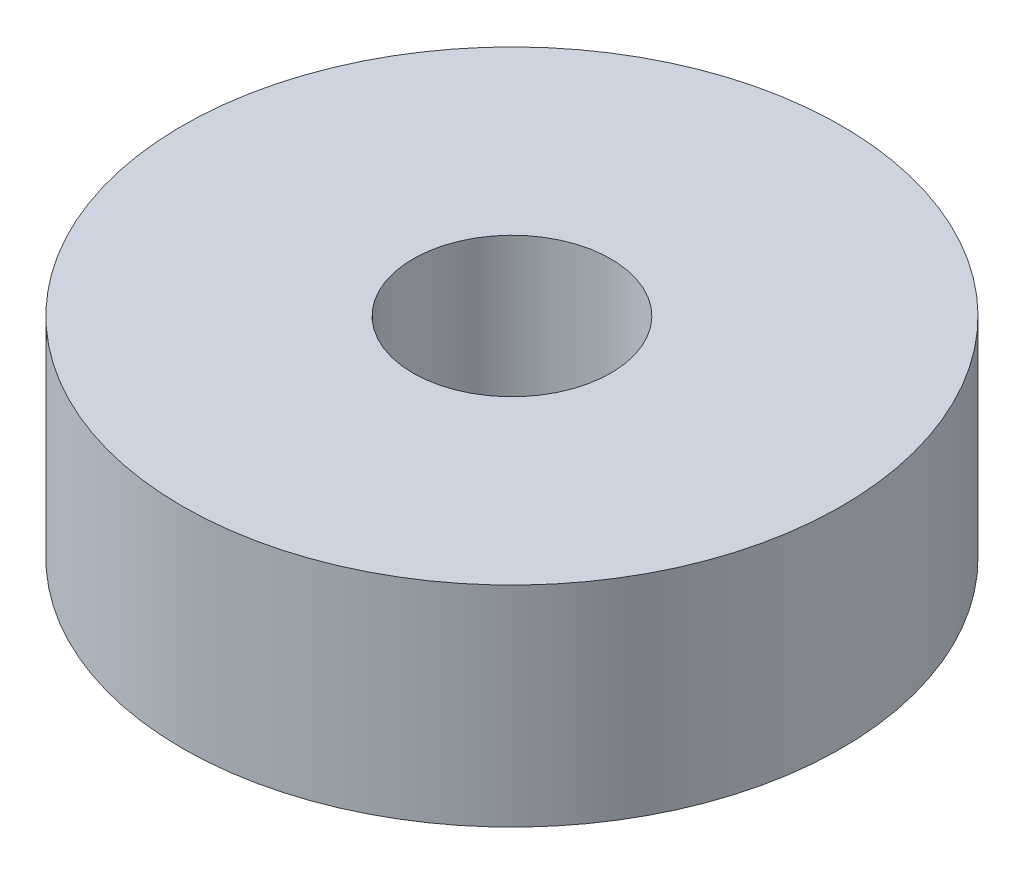
from build123d import *

# Parameters (mm, degrees)
SKETCH1_R           = 4.9911
SKETCH1_R_2         = 1.4986
BOSS_EXTRUDE1_DEPTH = 3.175


with BuildPart() as part:
    # Sketch1 → Boss-Extrude1 (new body)
    with BuildSketch(Plane(origin=(0, 0, 0), x_dir=(1, 0, 0), z_dir=(0, 1, 0))):
        with Locations(Location((1.683704156, 0.967834466, 0), (0, 0, 270))):
            Circle(SKETCH1_R)
        with Locations(Location((1.683704156, 0.967834466, 0), (0, 0, 270))):
            Circle(SKETCH1_R_2, mode=Mode.SUBTRACT)
    extrude(amount=BOSS_EXTRUDE1_DEPTH)


solid = part.part
